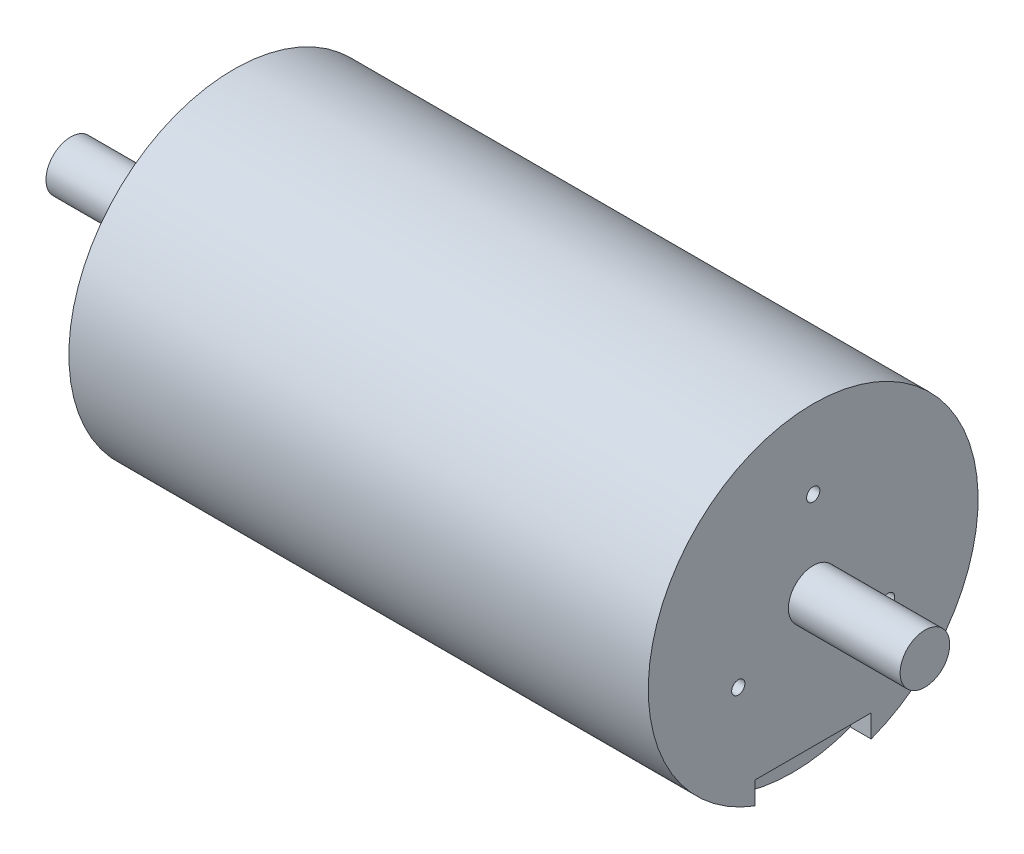
from build123d import *

# Parameters (mm, degrees)
SKETCH1_R          = 2.9945
EXTRUDE1_DEPTH     = 19.7
SKETCH2_R          = 10.975
EXTRUDE2_DEPTH     = 2.4
SKETCH3_R          = 19.925
EXTRUDE3_DEPTH     = 70
SKETCH4_R          = 2.9945
EXTRUDE4_DEPTH     = 13.5
SKETCH5_R          = 1.5
CUT_EXTRUDE1_DEPTH = 8
SKETCH6_R          = 0.8
CUT_EXTRUDE2_DEPTH = 4
CUT_EXTRUDE3_START = -2.5
CUT_EXTRUDE3_DEPTH = 2.5


with BuildPart() as part:
    # Sketch1 → Extrude1 (new body)
    with BuildSketch(Plane(origin=(0, 0, 0), x_dir=(0, 0, -1), z_dir=(1, 0, 0))):
        Circle(SKETCH1_R)
    extrude(amount=EXTRUDE1_DEPTH)

    # Sketch2 → Extrude2 (add)
    with BuildSketch(Plane(origin=(19.7, 0, 0), x_dir=(0, 0, -1), z_dir=(1, 0, 0))):
        Circle(SKETCH2_R)
    extrude(amount=-EXTRUDE2_DEPTH)

    # Sketch3 → Extrude3 (add)
    with BuildSketch(Plane(origin=(19.7, 0, 0), x_dir=(0, 0, -1), z_dir=(1, 0, 0))):
        Circle(SKETCH3_R)
    extrude(amount=EXTRUDE3_DEPTH)

    # Sketch4 → Extrude4 (add)
    with BuildSketch(Plane(origin=(89.7, 0, 0), x_dir=(0, 0, -1), z_dir=(1, 0, 0))):
        Circle(SKETCH4_R)
    extrude(amount=EXTRUDE4_DEPTH)

    # Sketch5 → Cut-Extrude1 (cut)
    with BuildSketch(Plane.ZY.offset(-19.7)):
        with Locations((11.313708499, 11.313708499)):
            Circle(SKETCH5_R)
        with Locations((11.313708499, -11.313708499)):
            Circle(SKETCH5_R)
        with Locations((-11.313708499, -11.313708499)):
            Circle(SKETCH5_R)
        with Locations((-11.313708499, 11.313708499)):
            Circle(SKETCH5_R)
    extrude(amount=-CUT_EXTRUDE1_DEPTH, mode=Mode.SUBTRACT)

    # Sketch6 → Cut-Extrude2 (cut)
    with BuildSketch(Plane(origin=(89.7, 0, 0), x_dir=(0, 0, -1), z_dir=(1, 0, 0))):
        with Locations((0, 10.45)):
            Circle(SKETCH6_R)
        with Locations((9.04996547, -5.225)):
            Circle(SKETCH6_R)
        with Locations((-9.04996547, -5.225)):
            Circle(SKETCH6_R)
    extrude(amount=-CUT_EXTRUDE2_DEPTH, mode=Mode.SUBTRACT)

    # Sketch7 → Cut-Extrude3 (cut)
    with BuildSketch(Plane(origin=(89.7, 0, 0), x_dir=(0, 0, -1), z_dir=(1, 0, 0)).offset(CUT_EXTRUDE3_START)):
        with BuildLine():
            Line((-7, -15.925), (7, -15.925))
            Line((7, -15.925), (7, -18.654908871))
            ThreePointArc((7, -18.654908871), (0, -19.925), (-7, -18.654908871))
            Line((-7, -18.654908871), (-7, -15.925))
        make_face()
    extrude(amount=CUT_EXTRUDE3_DEPTH, mode=Mode.SUBTRACT)


solid = part.part
